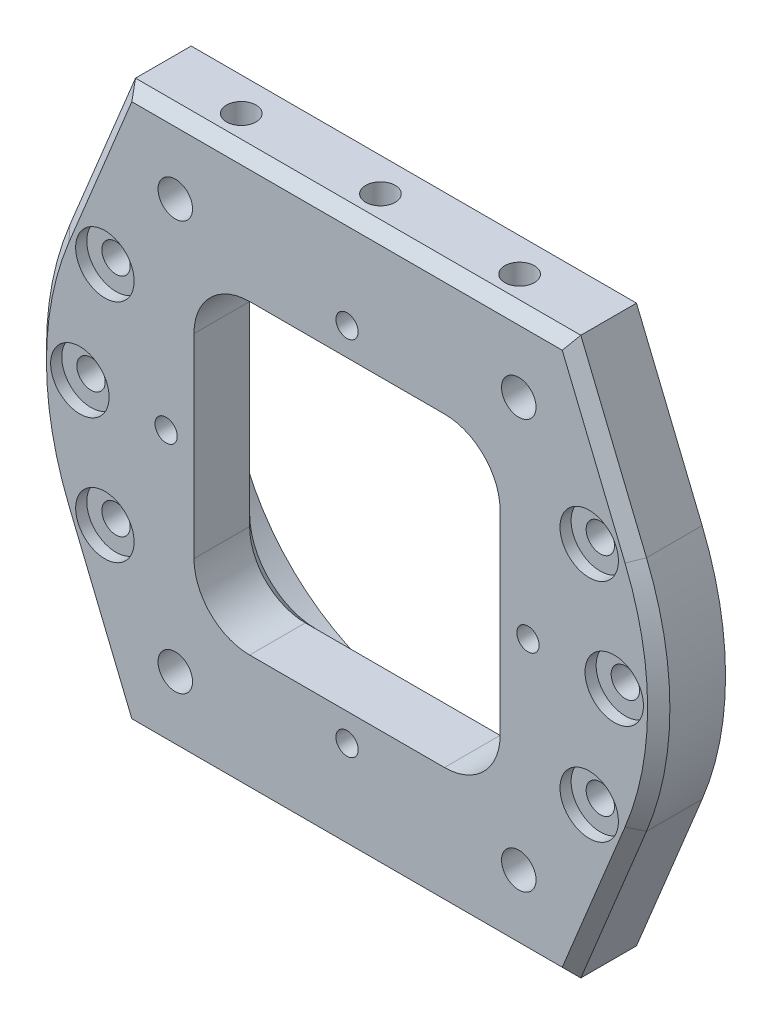
from build123d import *

# Parameters (mm, degrees)
EXTRUDE_1_DEPTH     = 12
SKETCH_3_R          = 2.65
CUT_EXTRUDE_1_DEPTH = 8
SKETCH_5_R          = 2.55
SKETCH_5_R_2        = 3.1
CUT_EXTRUDE_2_DEPTH = 77.026311235
SKETCH_7_R          = 5.25
CUT_EXTRUDE_3_DEPTH = 2
CHAMFER_3_SIZE      = 2
CUT_EXTRUDE_4_DEPTH = 12
SKETCH_9_R          = 39.85
SKETCH_9_R_2        = 36.85
EXTRUDE_2_DEPTH     = 4
SKETCH_10_R         = 2
CUT_EXTRUDE_5_DEPTH = 8
CHAMFER_4_SIZE      = 2
CHAMFER_5_SIZE      = 0.5


with BuildPart() as part:
    # Эскиз2 → Бобышка-Вытянуть1 (new body)
    with BuildSketch(Plane.XY):
        with BuildLine():
            Line((40, 50), (-40, 50))
            Line((-40, 50), (-51.798872756, 21.280901795))
            ThreePointArc((-51.798872756, 21.280901795), (-56, 0), (-51.798872756, -21.280901795))
            Line((-51.798872756, -21.280901795), (-40, -50))
            Line((-40, -50), (40, -50))
            Line((40, -50), (51.798872756, -21.280901795))
            ThreePointArc((51.798872756, -21.280901795), (56, 0), (51.798872756, 21.280901795))
            Line((51.798872756, 21.280901795), (40, 50))
        make_face()
    extrude(amount=EXTRUDE_1_DEPTH)

    # Эскиз3 → Вырез-Вытянуть1 (cut)
    with BuildSketch(Plane(origin=(0, 50, 0), x_dir=(1, 0, 0), z_dir=(0, 1, 0))):
        with Locations(Location((-25, -6, 0), (0, 0, 180))):
            Circle(SKETCH_3_R)
        with Locations(Location((0, -6, 0), (0, 0, 180))):
            Circle(SKETCH_3_R)
        with Locations(Location((25, -6, 0), (0, 0, 180))):
            Circle(SKETCH_3_R)
    cut_extrude_1 = extrude(amount=-CUT_EXTRUDE_1_DEPTH, mode=Mode.SUBTRACT)

    # Зеркальное отражение1: Вырез-Вытянуть1 across plane
    add(cut_extrude_1.mirror(Plane.ZX), mode=Mode.SUBTRACT)

    # Эскиз5 → Вырез-Вытянуть2 (cut, through all)
    with BuildSketch(Plane.XY.offset(12)):
        with Locations((-48, 0)):
            Circle(SKETCH_5_R)
        with Locations((-43.502773778, 20.285676564)):
            Circle(SKETCH_5_R)
        with Locations((-43.502773778, -20.285676564)):
            Circle(SKETCH_5_R)
        with Locations((-30.853805265, -36.77013327)):
            Circle(SKETCH_5_R_2)
        with Locations((-30.853805265, 36.77013327)):
            Circle(SKETCH_5_R_2)
        with Locations(Location((30.853805265, 36.77013327, 0), (0, 0, 180))):
            Circle(SKETCH_5_R_2)
        with Locations(Location((30.853805265, -36.77013327, 0), (0, 0, 180))):
            Circle(SKETCH_5_R_2)
        with Locations(Location((43.502773778, -20.285676564, 0), (0, 0, 180))):
            Circle(SKETCH_5_R)
        with Locations(Location((43.502773778, 20.285676564, 0), (0, 0, 180))):
            Circle(SKETCH_5_R)
        with Locations(Location((48, 0, 0), (0, 0, 180))):
            Circle(SKETCH_5_R)
    extrude(amount=-CUT_EXTRUDE_2_DEPTH, mode=Mode.SUBTRACT)

    # Эскиз7 → Вырез-Вытянуть3 (cut)
    with BuildSketch(Plane.XY.offset(12)):
        with Locations((-43.502773778, 20.285676564)):
            Circle(SKETCH_7_R)
        with Locations((-48, 0)):
            Circle(SKETCH_7_R)
        with Locations((-43.502773778, -20.285676564)):
            Circle(SKETCH_7_R)
        with Locations((43.502773778, 20.285676564)):
            Circle(SKETCH_7_R)
        with Locations((48, 0)):
            Circle(SKETCH_7_R)
        with Locations((43.502773778, -20.285676564)):
            Circle(SKETCH_7_R)
    extrude(amount=-CUT_EXTRUDE_3_DEPTH, mode=Mode.SUBTRACT)

    # Фаска3
    chamfer_3_edges = [part.edges().sort_by_distance(p)[0] for p in [
        (0, -50, 12),
        (45.899436378, -35.640450898, 12),
        (56, 0, 12),
        (45.899436378, 35.640450898, 12),
        (0, 50, 12),
        (-45.899436378, 35.640450898, 12),
        (-56, 0, 12),
        (-45.899436378, -35.640450898, 12),
    ]]
    chamfer(chamfer_3_edges, length=CHAMFER_3_SIZE)

    # Эскиз8 → Вырез-Вытянуть4 (cut)
    with BuildSketch(Plane.XY.offset(12)):
        with BuildLine():
            Line((-17.5, -27.5), (17.5, -27.5))
            ThreePointArc((17.5, -27.5), (24.571067812, -24.571067812), (27.5, -17.5))
            Line((27.5, -17.5), (27.5, 17.5))
            ThreePointArc((27.5, 17.5), (24.571067812, 24.571067812), (17.5, 27.5))
            Line((17.5, 27.5), (-17.5, 27.5))
            ThreePointArc((-17.5, 27.5), (-24.571067812, 24.571067812), (-27.5, 17.5))
            Line((-27.5, 17.5), (-27.5, -17.5))
            ThreePointArc((-27.5, -17.5), (-24.571067812, -24.571067812), (-17.5, -27.5))
        make_face()
    extrude(amount=-CUT_EXTRUDE_4_DEPTH, mode=Mode.SUBTRACT)

    # Эскиз9 → Бобышка-Вытянуть2 (add)
    with BuildSketch(Plane(origin=(0, 0, 0), x_dir=(-1, 0, 0), z_dir=(0, 0, -1))):
        Circle(SKETCH_9_R)
        Circle(SKETCH_9_R_2, mode=Mode.SUBTRACT)
    extrude(amount=EXTRUDE_2_DEPTH)

    # Эскиз10 → Вырез-Вытянуть5 (cut)
    with BuildSketch(Plane.XY.offset(12)):
        with Locations((0, 32.5)):
            Circle(SKETCH_10_R)
        with Locations((32.5, 0)):
            Circle(SKETCH_10_R)
        with Locations((0, -32.5)):
            Circle(SKETCH_10_R)
        with Locations((-32.5, 0)):
            Circle(SKETCH_10_R)
    extrude(amount=-CUT_EXTRUDE_5_DEPTH, mode=Mode.SUBTRACT)

    # Фаска4
    chamfer_4_edges = [part.edges().sort_by_distance(p)[0] for p in [
        (24.571067812, 24.571067812, 0),
        (27.5, 0, 0),
        (24.571067812, -24.571067812, 0),
        (0, -27.5, 0),
        (-24.571067812, -24.571067812, 0),
        (-27.5, 0, 0),
        (-24.571067812, 24.571067812, 0),
        (0, 27.5, 0),
    ]]
    chamfer(chamfer_4_edges, length=CHAMFER_4_SIZE)

    # Фаска5
    chamfer_5_edges = [part.edges().sort_by_distance(p)[0] for p in [
        (39.85, 0, -4),
    ]]
    chamfer(chamfer_5_edges, length=CHAMFER_5_SIZE)


solid = part.part
